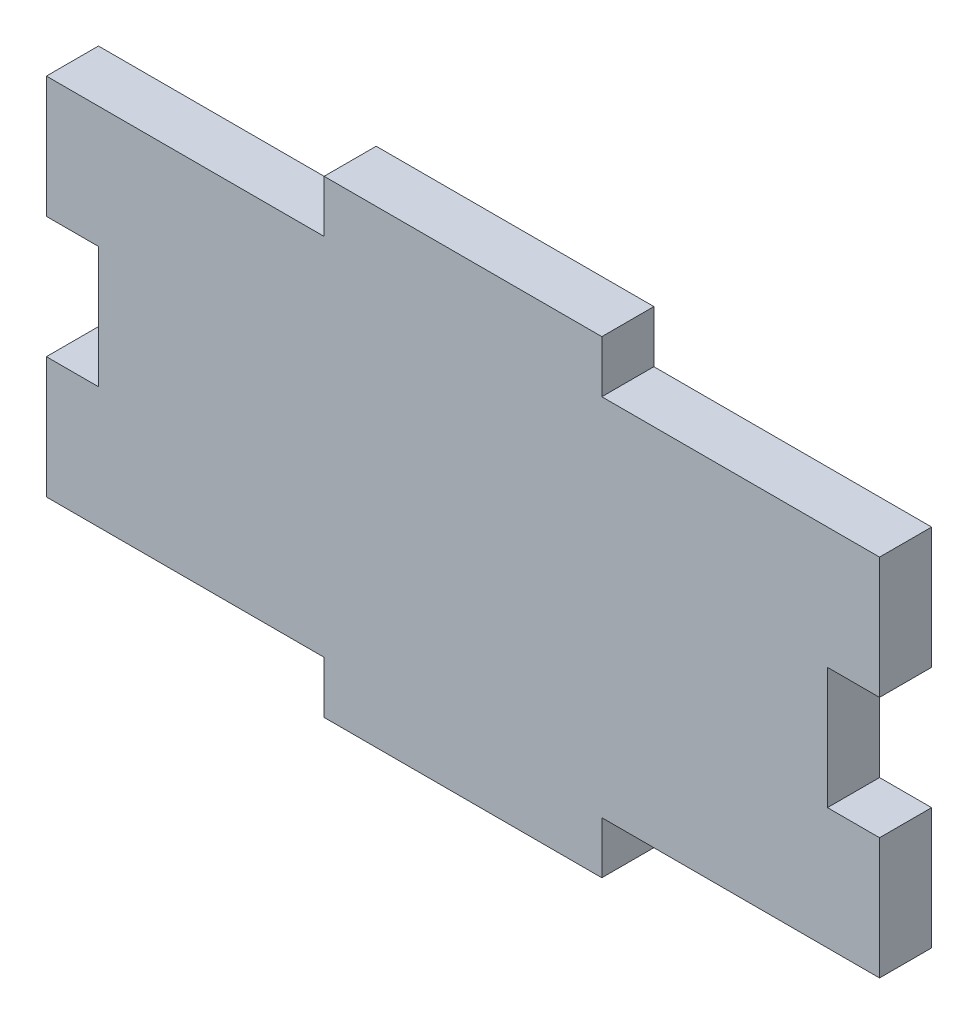
from build123d import *

# Parameters (mm, degrees)
BOSS_EXTRUDE1_DEPTH = 3


with BuildPart() as part:
    # Sketch1 → Boss-Extrude1 (new body)
    with BuildSketch(Plane.XY):
        Polygon((-24, 10.5), (-8, 10.5), (-8, 13.5), (8, 13.5), (8, 10.5), (24, 10.5), (24, 3.5), (21, 3.5), (21, -3.5), (24, -3.5), (24, -10.5), (8, -10.5), (8, -13.5), (-8, -13.5), (-8, -10.5), (-24, -10.5), (-24, -3.5), (-21, -3.5), (-21, 3.5), (-24, 3.5), align=None)
    extrude(amount=BOSS_EXTRUDE1_DEPTH)


solid = part.part
